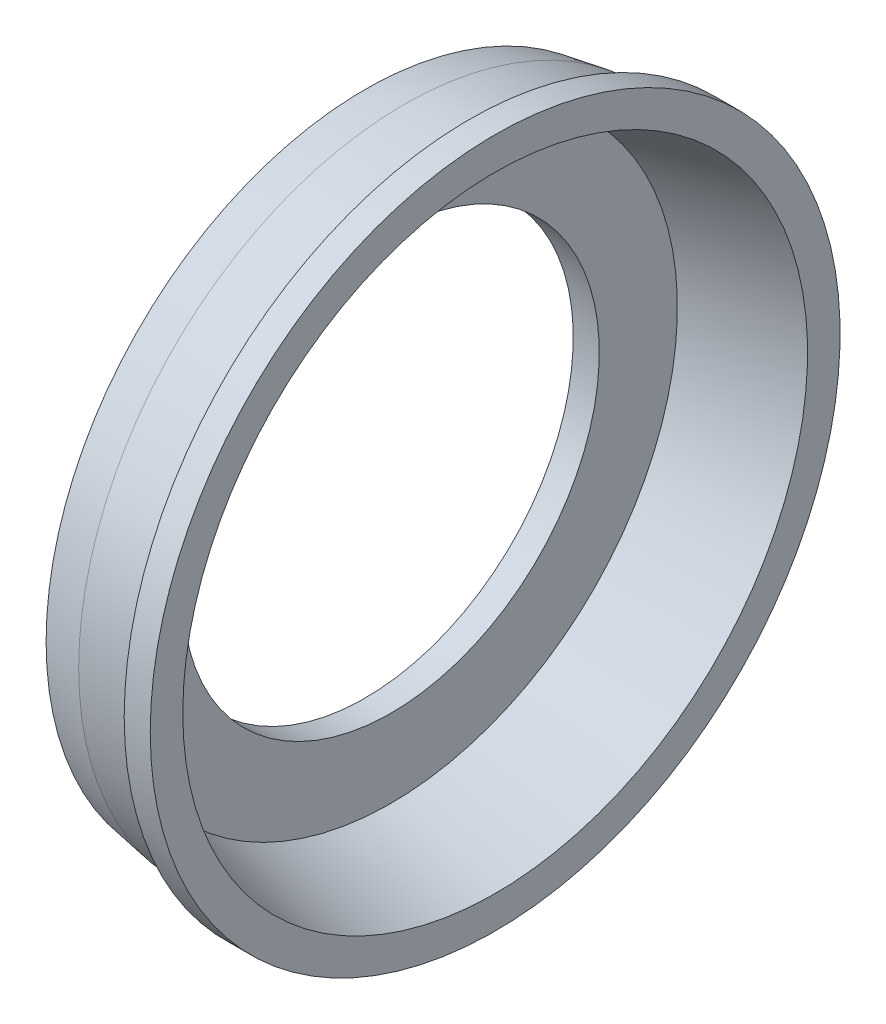
from build123d import *

# Parameters (mm, degrees)
SFAZOWANIE1_SIZE  = 3
SFAZOWANIE1_SIZE2 = 0.5


with BuildPart() as part:
    # Szkic1 → Obrót1 (revolve)
    with BuildSketch(Plane.XY, mode=Mode.PRIVATE) as obr_t1_sk:
        Polygon((0, 26.5), (2, 26.5), (2, 24), (-6, 22), (-6, 16), (-8, 16), (-8, 25), (0, 25), align=None)
    revolve(obr_t1_sk.sketch.rotate(Axis((-21.448486922, 0, 0), (1, 0, 0)), 90), axis=Axis((-21.448486922, 0, 0), (1, 0, 0)))

    # Sfazowanie1
    sfazowanie1_edges = [part.edges().sort_by_distance(p)[0] for p in [
        (-8, 0, -25),
    ]]
    sfazowanie1_side = [part.faces().sort_by_distance(p)[0] for p in [
        (-4, 0, -25),
    ]]
    chamfer(sfazowanie1_edges, length=SFAZOWANIE1_SIZE, length2=SFAZOWANIE1_SIZE2, reference=sfazowanie1_side[0])


solid = part.part
